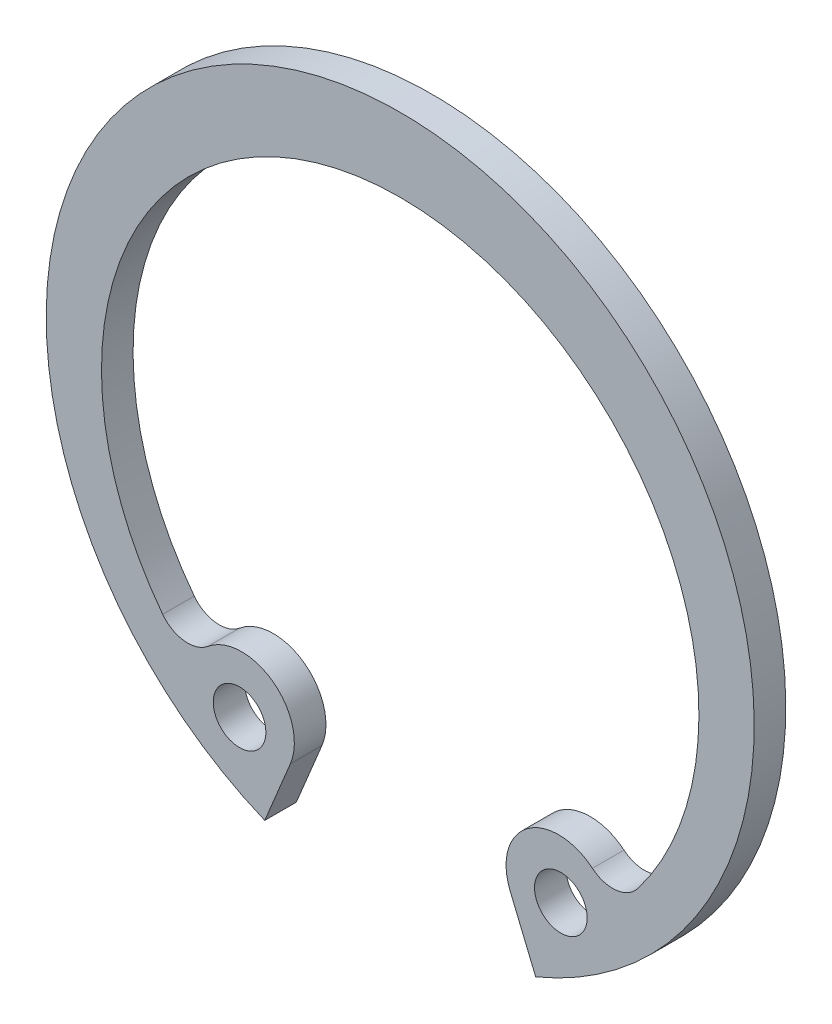
from build123d import *

# Parameters (mm, degrees)
SKETCH_1_R        = 1
EXTRUDE_886_DEPTH = 1.2


with BuildPart() as part:
    # 草图1 → Extrude 886 (new body)
    with BuildSketch(Plane.XY):
        with BuildLine():
            Line((-4.17437466, -10.077831919), (-5.147092165, -12.426179712))
            ThreePointArc((-5.147092165, -12.426179712), (0, 13.45), (5.147092165, -12.426179712))
            Line((5.147092165, -12.426179712), (4.17437466, -10.077831919))
            ThreePointArc((4.17437466, -10.077831919), (4.836931805, -7.701472688), (7.302792981, -7.776264589))
            ThreePointArc((7.302792981, -7.776264589), (8.205543329, -8.046999251), (9.02541772, -7.582175163))
            ThreePointArc((9.02541772, -7.582175163), (0, 10.65), (-9.02541772, -7.582175163))
            ThreePointArc((-9.02541772, -7.582175163), (-8.205543329, -8.046999251), (-7.302792981, -7.776264589))
            ThreePointArc((-7.302792981, -7.776264589), (-4.836931805, -7.701472688), (-4.17437466, -10.077831919))
        make_face()
        with Locations((-6.103811358, -9.509652302)):
            Circle(SKETCH_1_R, mode=Mode.SUBTRACT)
        with Locations(Location((6.103811358, -9.509652302, 0), (0, 0, 180))):
            Circle(SKETCH_1_R, mode=Mode.SUBTRACT)
    extrude(amount=EXTRUDE_886_DEPTH)


solid = part.part
